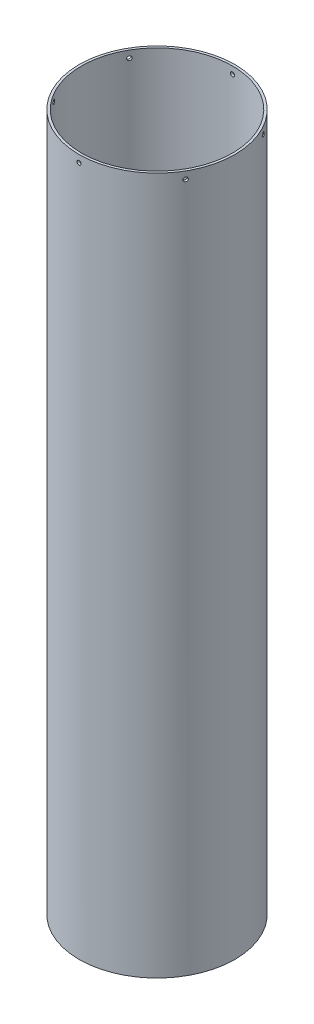
from build123d import *

# Parameters (mm, degrees)
SKETCH1_R           = 51.1048
SKETCH1_R_2         = 49.53
BOSS_EXTRUDE1_DEPTH = 457.2
SKETCH2_R           = 1.35255
CUT_EXTRUDE1_DEPTH  = 463.877133985
CIRPATTERN1_COUNT   = 6


with BuildPart() as part:
    # Sketch1 → Boss-Extrude1 (new body)
    with BuildSketch(Plane(origin=(0, 0, 0), x_dir=(1, 0, 0), z_dir=(0, 1, 0))):
        with Locations(Location((0, 0, 0), (0, 0, 270))):
            Circle(SKETCH1_R)
        with Locations(Location((0, 0, 0), (0, 0, 270))):
            Circle(SKETCH1_R_2, mode=Mode.SUBTRACT)
    extrude(amount=BOSS_EXTRUDE1_DEPTH)

    # Sketch2 → Cut-Extrude1 (cut, through all)
    with BuildSketch(Plane.XY):
        with Locations(Location((0, 452.4375, 0), (0, 0, 90))):
            Circle(SKETCH2_R)
    cut_extrude1 = extrude(amount=-CUT_EXTRUDE1_DEPTH, mode=Mode.SUBTRACT)

    # CirPattern1: Cut-Extrude1 ×6 about axis
    cirpattern1_axis = Axis((0, 457.2, 0), (0, -1, 0))
    for i in range(1, CIRPATTERN1_COUNT):
        add(cut_extrude1.rotate(cirpattern1_axis, i * 360 / CIRPATTERN1_COUNT), mode=Mode.SUBTRACT)


solid = part.part
